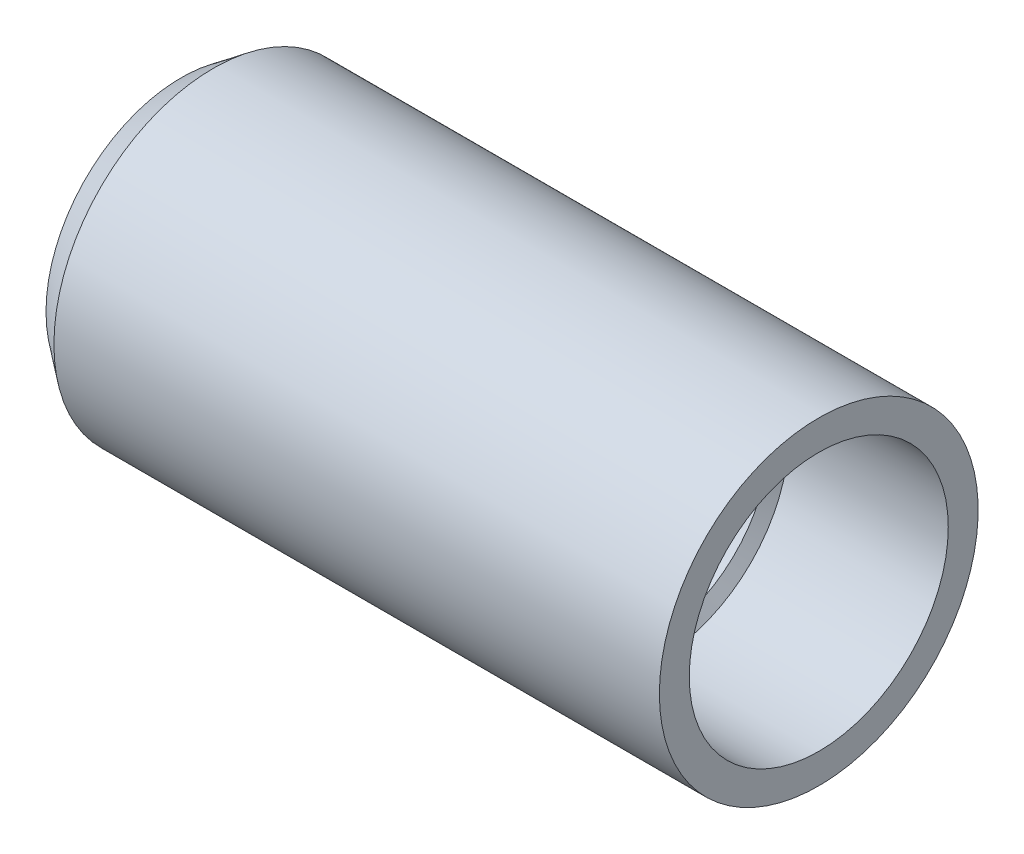
from build123d import *

# Parameters (mm, degrees)
F_7_8_14_TAPPED_HOLE1_D     = 20.6375
F_7_8_14_TAPPED_HOLE1_DEPTH = 12.7
F_7_8_14_TAPPED_HOLE1_TIP   = 6.200130513


with BuildPart() as part:
    # Sketch2 → Revolve1 (revolve)
    with BuildSketch(Plane.XY, mode=Mode.PRIVATE) as revolve1_sk:
        Polygon((0, 10.771663062), (2.558989547, 12.7), (50.8, 12.7), (50.8, 9.35355), (25.4, 9.35355), (25.4, 5.55625), (0, 5.55625), align=None)
    revolve(revolve1_sk.sketch.rotate(Axis((0, 0, 0), (1, 0, 0)), 90), axis=Axis((0, 0, 0), (1, 0, 0)))

    # 7/8-14 Tapped Hole1
    with Locations(Plane(origin=(50.8, 0, 0), x_dir=(0, 0, -1), z_dir=(1, 0, 0))):
        with Locations((0, 0)):
            Hole(F_7_8_14_TAPPED_HOLE1_D / 2, depth=F_7_8_14_TAPPED_HOLE1_DEPTH)
            with Locations((0, 0, -(F_7_8_14_TAPPED_HOLE1_DEPTH + F_7_8_14_TAPPED_HOLE1_TIP / 2))):  # 118° drill point
                Cone(0, F_7_8_14_TAPPED_HOLE1_D / 2, F_7_8_14_TAPPED_HOLE1_TIP, mode=Mode.SUBTRACT)


solid = part.part
